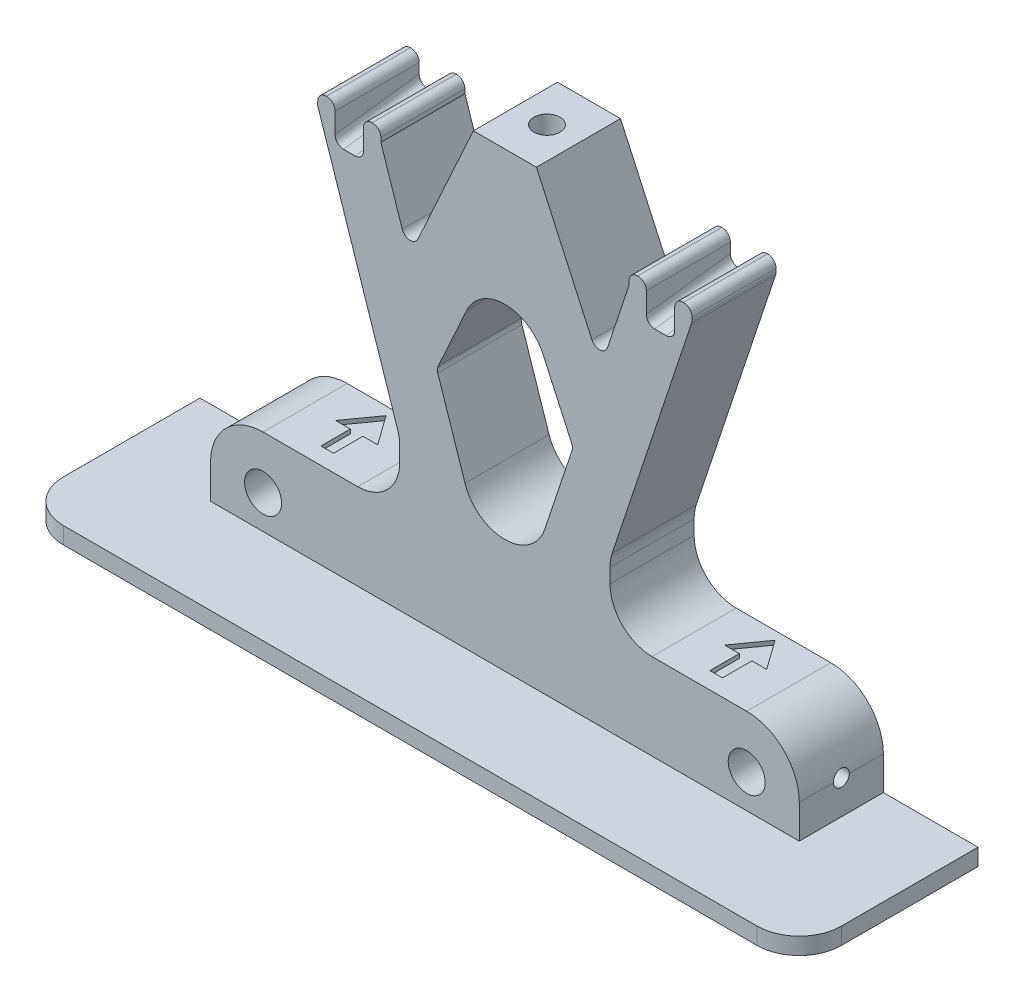
from build123d import *

# Parameters (mm, degrees)
SKETCH1_R           = 4.4
BOSS_EXTRUDE1_DEPTH = 20
FILLET1_R           = 10
SKETCH2_W           = 6.75
SKETCH2_H           = 6.75
CUT_EXTRUDE1_DEPTH  = 124.17331296
SKETCH3_W           = 4.125
SKETCH3_H           = 20
BOSS_EXTRUDE2_DEPTH = 3
FILLET2_R           = 2
BOSS_EXTRUDE3_DEPTH = 20
FILLET3_R           = 10
FILLET4_R           = 2
SKETCH5_R           = 3.1
CUT_EXTRUDE2_DEPTH  = 15
SKETCH6_W           = 185
SKETCH6_H           = 4
BOSS_EXTRUDE4_DEPTH = 42.5
FILLET5_R           = 10
CUT_EXTRUDE3_DEPTH  = 1
SKETCH8_R           = 1.9
CUT_EXTRUDE4_DEPTH  = 10


with BuildPart() as part:
    # Sketch1 → Boss-Extrude1 (new body)
    with BuildSketch(Plane.XY):
        with BuildLine():
            Line((-70, 0), (70, 0))
            Line((70, 0), (70, 12))
            ThreePointArc((70, 12), (66.338834765, 20.838834765), (57.5, 24.5))
            Line((57.5, 24.5), (25, 24.5))
            Line((25, 24.5), (25, 39.5))
            Line((25, 39.5), (44.5, 98.165))
            Line((44.5, 98.165), (29.5, 98.165))
            Line((29.5, 98.165), (0, 9.415384615))
            Line((0, 9.415384615), (-29.5, 98.165))
            Line((-29.5, 98.165), (-44.5, 98.165))
            Line((-44.5, 98.165), (-25, 39.5))
            Line((-25, 39.5), (-25, 24.5))
            Line((-25, 24.5), (-57.5, 24.5))
            ThreePointArc((-57.5, 24.5), (-66.338834765, 20.838834765), (-70, 12))
            Line((-70, 12), (-70, 0))
        make_face()
        with Locations((-57.5, 12)):
            Circle(SKETCH1_R, mode=Mode.SUBTRACT)
        with Locations(Location((57.5, 12, 0), (0, 0, 180))):
            Circle(SKETCH1_R, mode=Mode.SUBTRACT)
    extrude(amount=BOSS_EXTRUDE1_DEPTH)

    # Fillet1
    fillet1_edges = [part.edges().sort_by_distance(p)[0] for p in [
        (25, 39.5, 10),
        (25, 24.5, 10),
        (-25, 24.5, 10),
        (-25, 39.5, 10),
        (0, 9.415384615, 10),
    ]]
    fillet(fillet1_edges, radius=FILLET1_R)

    # Sketch2 → Cut-Extrude1 (cut, through all, along a direction that is not the sketch's normal)
    with BuildSketch(Plane.XY):
        with Locations((37, 98.165)):
            Rectangle(SKETCH2_W, SKETCH2_H)
        with Locations((-37, 98.165)):
            Rectangle(SKETCH2_W, SKETCH2_H)
    extrude(amount=CUT_EXTRUDE1_DEPTH, dir=(0, -0.12403473458920856, 0.9922778767136676), mode=Mode.SUBTRACT)

    # Sketch3 → Boss-Extrude2 (add)
    with BuildSketch(Plane(origin=(0, 98.165, 0), x_dir=(1, 0, 0), z_dir=(0, 1, 0))):
        with Locations((42.4375, -10)):
            Rectangle(SKETCH3_W, SKETCH3_H)
        with Locations((31.5625, -10)):
            Rectangle(SKETCH3_W, SKETCH3_H)
        with Locations((-31.5625, -10)):
            Rectangle(SKETCH3_W, SKETCH3_H)
        with Locations((-42.4375, -10)):
            Rectangle(SKETCH3_W, SKETCH3_H)
    extrude(amount=BOSS_EXTRUDE2_DEPTH)

    # Fillet2
    fillet2_edges = [part.edges().sort_by_distance(p)[0] for p in [
        (-40.375, 93.54, 10),
        (-33.625, 93.54, 10),
        (44.5, 101.165, 10),
        (40.375, 101.165, 10),
        (29.5, 101.165, 10),
        (33.625, 101.165, 10),
        (-29.5, 101.165, 10),
        (-33.625, 101.165, 10),
        (-44.5, 101.165, 10),
        (-40.375, 101.165, 10),
        (44.5, 98.165, 10),
        (33.625, 93.54, 10),
        (40.375, 93.54, 10),
    ]]
    fillet(fillet2_edges, radius=FILLET2_R)

    # Sketch4 → Boss-Extrude3 (add)
    with BuildSketch(Plane.XY.offset(20)):
        Polygon((-22.793222795, 77.98791873), (-7.5, 111.54), (7.5, 111.54), (22.793222795, 77.98791873), (16.196275804, 58.141257439), (0, 93.674563227), (-16.196275804, 58.141257439), align=None)
    extrude(amount=-BOSS_EXTRUDE3_DEPTH)

    # Fillet3
    fillet3_edges = [part.edges().sort_by_distance(p)[0] for p in [
        (0, 93.674563227, 10),
    ]]
    fillet(fillet3_edges, radius=FILLET3_R)

    # Fillet4
    fillet4_edges = [part.edges().sort_by_distance(p)[0] for p in [
        (16.196275804, 58.141257439, 10),
        (22.793222795, 77.98791873, 10),
        (-22.793222795, 77.98791873, 10),
        (-16.196275804, 58.141257439, 10),
    ]]
    fillet(fillet4_edges, radius=FILLET4_R)

    # Sketch5 → Cut-Extrude2 (cut)
    with BuildSketch(Plane(origin=(0, 111.54, 0), x_dir=(1, 0, 0), z_dir=(0, 1, 0))):
        with Locations(Location((0, -10, 0), (0, 0, 270))):
            Circle(SKETCH5_R)
    extrude(amount=-CUT_EXTRUDE2_DEPTH, mode=Mode.SUBTRACT)

    # Sketch6 → Boss-Extrude4 (add)
    with BuildSketch(Plane(origin=(0, 0, 0), x_dir=(-1, 0, 0), z_dir=(0, 0, -1))):
        with Locations((0, 2)):
            Rectangle(SKETCH6_W, SKETCH6_H)
    extrude(amount=-BOSS_EXTRUDE4_DEPTH)

    # Fillet5
    fillet5_edges = [part.edges().sort_by_distance(p)[0] for p in [
        (-92.5, 2, 42.5),
        (92.5, 2, 42.5),
    ]]
    fillet(fillet5_edges, radius=FILLET5_R)

    # Sketch7 → Cut-Extrude3 (cut)
    with BuildSketch(Plane(origin=(0, 24.5, 0), x_dir=(1, 0, 0), z_dir=(0, 1, 0))):
        Polygon((41.25, -9), (46.25, -2), (51.25, -9), (47.75, -9), (47.75, -16), (44.75, -16), (44.75, -9), align=None)
    cut_extrude3 = extrude(amount=-CUT_EXTRUDE3_DEPTH, mode=Mode.SUBTRACT)

    # Sketch8 → Cut-Extrude4 (cut)
    with BuildSketch(Plane(origin=(70, 0, 0), x_dir=(0, 0, -1), z_dir=(1, 0, 0))):
        with Locations((-10, 12)):
            Circle(SKETCH8_R)
    cut_extrude4 = extrude(amount=-CUT_EXTRUDE4_DEPTH, mode=Mode.SUBTRACT)

    # Mirror1: Cut-Extrude3, Cut-Extrude4 across plane
    add(cut_extrude3.mirror(Plane(origin=(0, 0, 0), x_dir=(0, 0, 1), z_dir=(1, 0, 0))), mode=Mode.SUBTRACT)
    add(cut_extrude4.mirror(Plane(origin=(0, 0, 0), x_dir=(0, 0, 1), z_dir=(1, 0, 0))), mode=Mode.SUBTRACT)


solid = part.part
